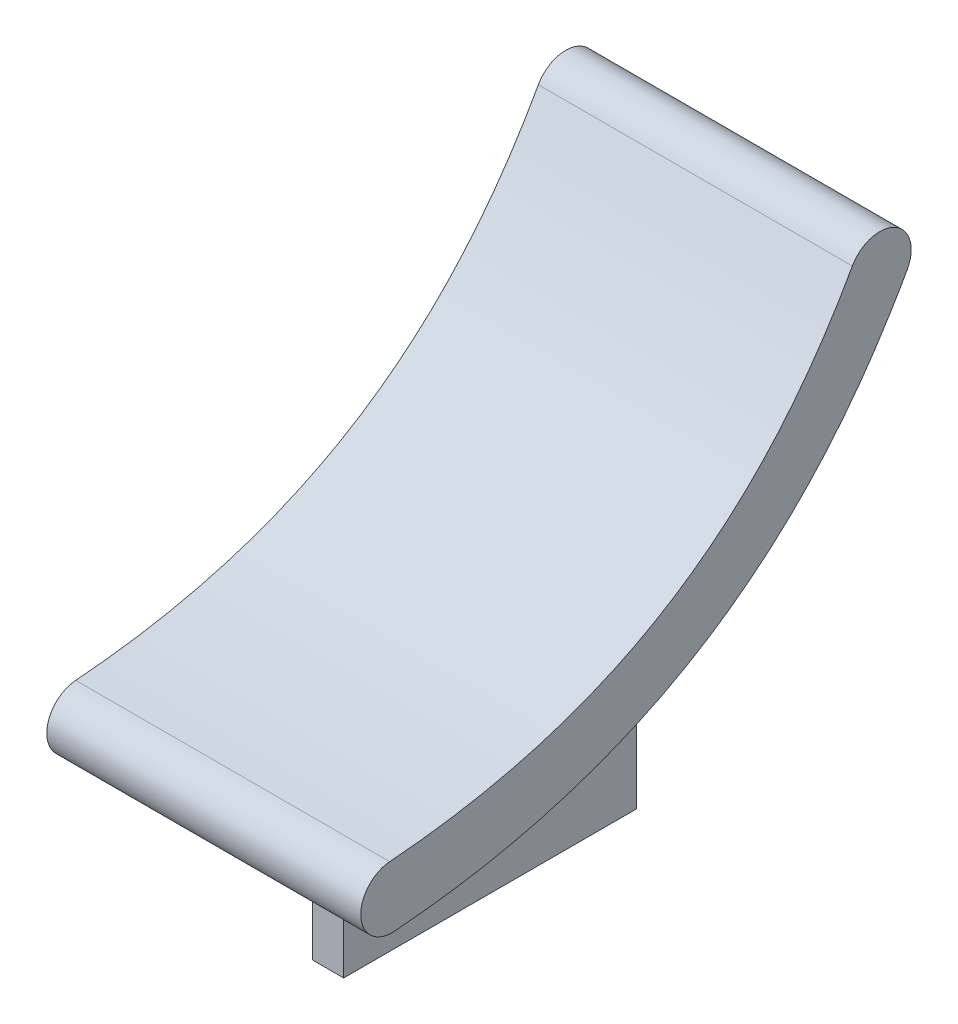
from build123d import *

# Parameters (mm, degrees)
BOSS_EXTRUDE1_DEPTH = 0.75
BOSS_EXTRUDE2_DEPTH = 7.5


with BuildPart() as part:
    # Sketch1 → Boss-Extrude1 (new, symmetric)
    with BuildSketch(Plane(origin=(0, 0, 0), x_dir=(0, 0, -1), z_dir=(1, 0, 0))):
        Polygon((0, 0), (14, 0), (14, 18), (0, 8), align=None)
    extrude(amount=BOSS_EXTRUDE1_DEPTH, both=True)

    # Sketch2 → Boss-Extrude2 (add, symmetric)
    with BuildSketch(Plane(origin=(0, 0, 0), x_dir=(0, 0, -1), z_dir=(1, 0, 0))):
        with BuildLine():
            ThreePointArc((-4.550304812, 10.464286171), (-5.928476621, 8.851635414), (-4.315825864, 7.473463604))
            add(Edge.make_bspline(
                [(-4.315825864, 7.473463604), (-3.583243131, 7.530897713), (-2.100585043, 7.6832237), (0.68576379, 8.118340384), (3.956902233, 8.917185571), (7.520727195, 10.282481231), (10.736128846, 12.048694485), (13.599295228, 14.193658518), (16.119096641, 16.686751031), (18.30906232, 19.477622478), (19.58868963, 21.545750976), (20.174187061, 22.599110502)],
                knots=[0, 0, 0, 0, 0.0625, 0.125, 0.25, 0.375, 0.5, 0.625, 0.75, 0.875, 1, 1, 1, 1], degree=3))
            ThreePointArc((20.174187061, 22.599110502), (19.591855999, 24.638936606), (17.552029895, 24.056605543))
            add(Edge.make_bspline(
                [(-4.550304812, 10.464286171), (6.637685906, 11.341418876), (13.172377699, 16.177239873), (17.552029895, 24.056605543)],
                knots=[0, 0, 0, 0, 1, 1, 1, 1], degree=3))
        make_face()
    extrude(amount=BOSS_EXTRUDE2_DEPTH, both=True)


solid = part.part
